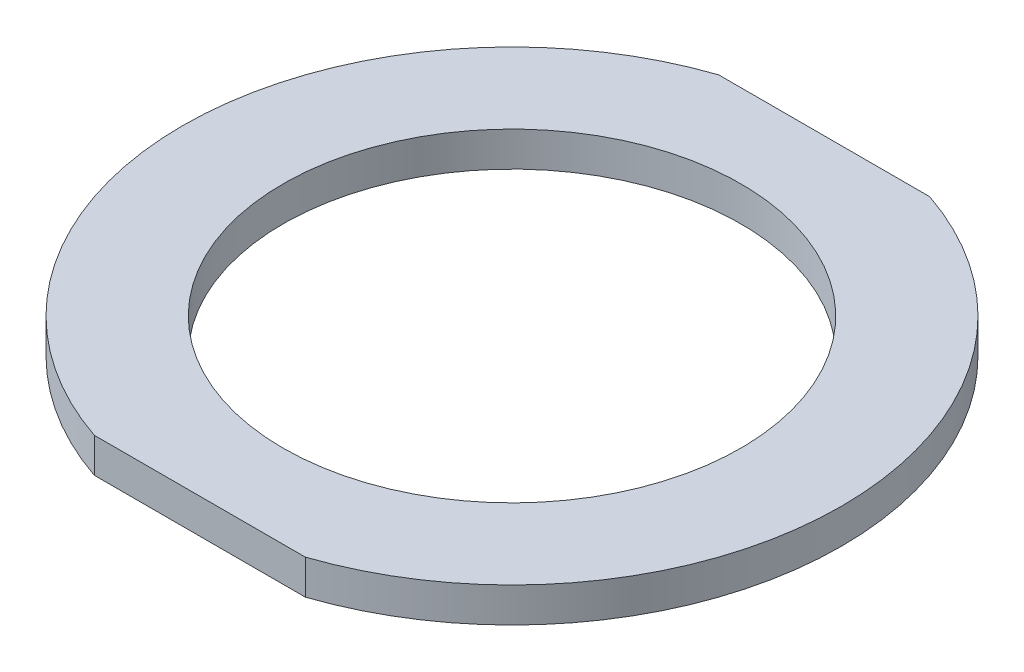
from build123d import *

# Parameters (mm, degrees)
SKETCH_1_R          = 47.5
SKETCH_1_R_2        = 33
EXTRUDE_1_DEPTH     = 5
SKETCH_2_W          = 10
SKETCH_2_H          = 30
CUT_EXTRUDE_1_DEPTH = 25


with BuildPart() as part:
    # Эскиз1 → Бобышка-Вытянуть1 (new body)
    with BuildSketch(Plane(origin=(0, 0, 0), x_dir=(1, 0, 0), z_dir=(0, 1, 0))):
        with Locations(Location((0, 0, 0), (0, 0, 270))):
            Circle(SKETCH_1_R)
        with Locations(Location((0, 0, 0), (0, 0, 270))):
            Circle(SKETCH_1_R_2, mode=Mode.SUBTRACT)
    extrude(amount=EXTRUDE_1_DEPTH)

    # Эскиз2 → Вырез-Вытянуть1 (cut, symmetric)
    with BuildSketch(Plane(origin=(0, 0, 0), x_dir=(0, 0, -1), z_dir=(1, 0, 0))):
        with Locations((-50, 0)):
            Rectangle(SKETCH_2_W, SKETCH_2_H)
        with Locations((50, 0)):
            Rectangle(SKETCH_2_W, SKETCH_2_H)
    extrude(amount=CUT_EXTRUDE_1_DEPTH, both=True, mode=Mode.SUBTRACT)


solid = part.part
